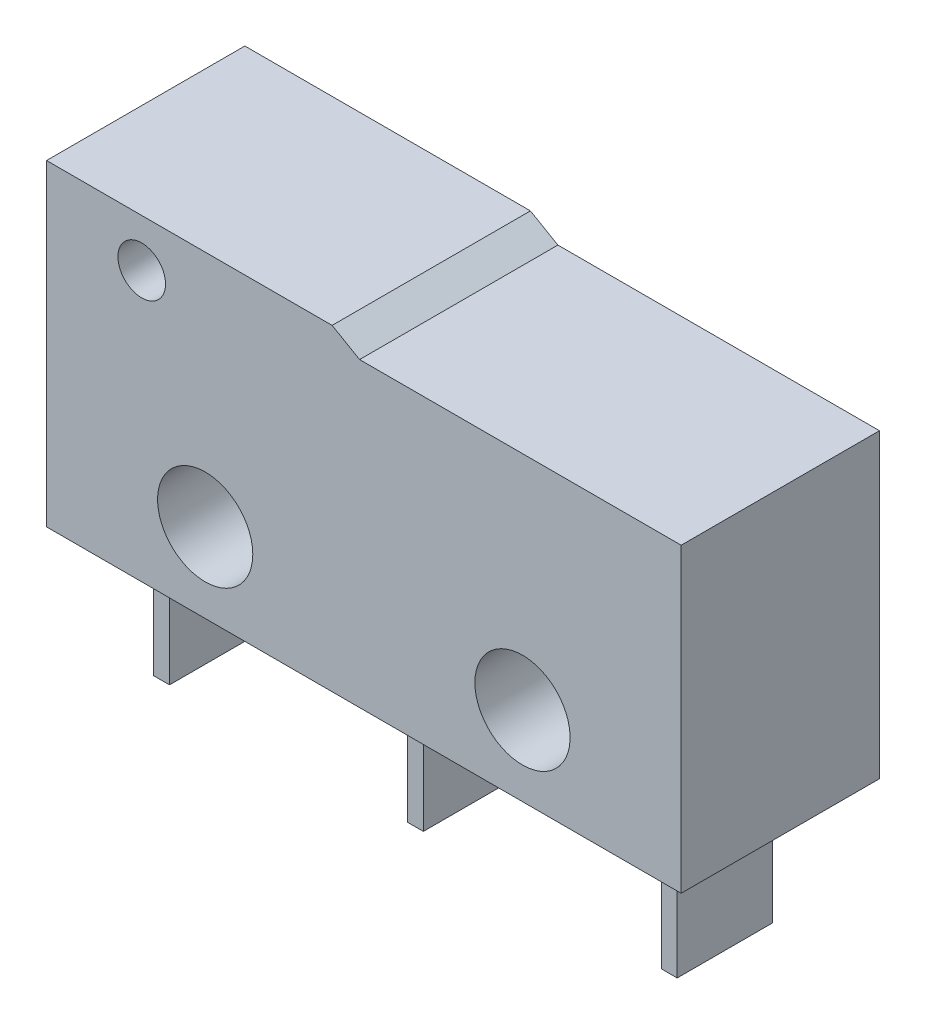
from build123d import *

# Parameters (mm, degrees)
SKETCH1_R           = 1.5
SKETCH1_R_2         = 0.75
BOSS_EXTRUDE1_DEPTH = 3.125
SKETCH2_W           = 0.5
SKETCH2_H           = 3
BOSS_EXTRUDE2_DEPTH = 4


with BuildPart() as part:
    # Sketch1 → Boss-Extrude1 (new, symmetric)
    with BuildSketch(Plane.XY):
        Polygon((10, 0), (-10, 0), (-10, 10), (-1, 10), (-0.133974596, 9.5), (10, 9.5), align=None)
        with Locations((-5, 2.5)):
            Circle(SKETCH1_R, mode=Mode.SUBTRACT)
        with Locations(Location((5, 2.5, 0), (0, 0, 180))):
            Circle(SKETCH1_R, mode=Mode.SUBTRACT)
        with Locations((-7, 8.5)):
            Circle(SKETCH1_R_2, mode=Mode.SUBTRACT)
    extrude(amount=BOSS_EXTRUDE1_DEPTH, both=True)

    # Sketch2 → Boss-Extrude2 (add)
    with BuildSketch(Plane.XZ):
        Rectangle(SKETCH2_W, SKETCH2_H)
        with Locations((-8, 0)):
            Rectangle(SKETCH2_W, SKETCH2_H)
        with Locations((8, 0)):
            Rectangle(SKETCH2_W, SKETCH2_H)
    extrude(amount=BOSS_EXTRUDE2_DEPTH)


solid = part.part
